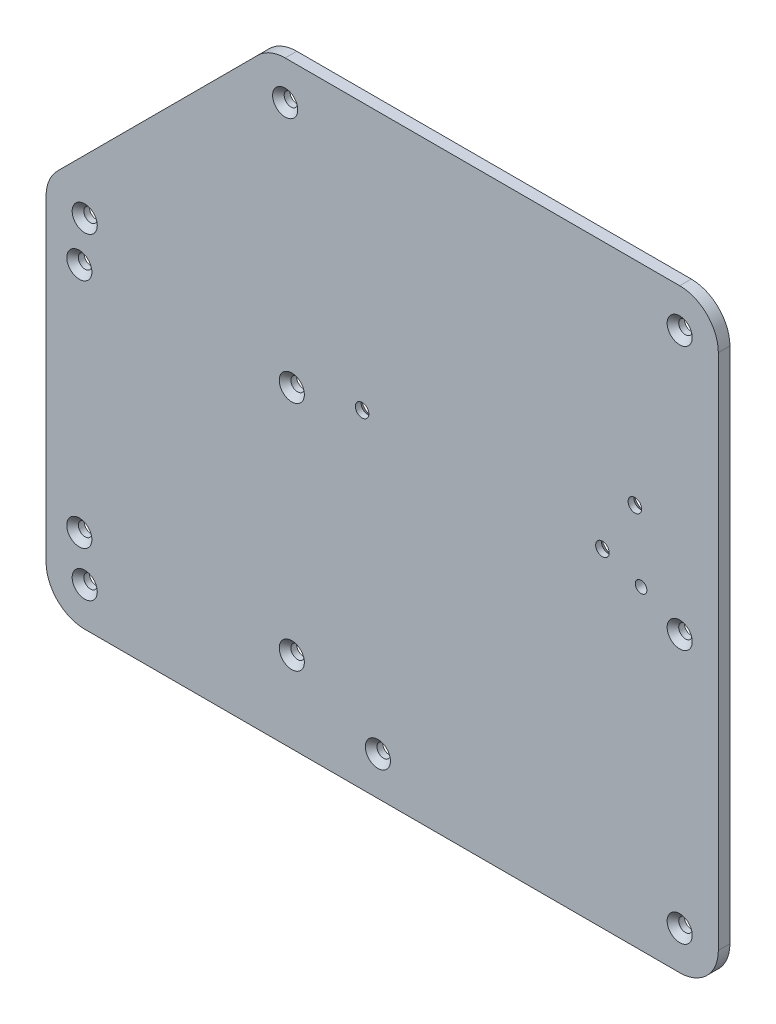
from build123d import *

# Parameters (mm, degrees)
ESTRUSIONE_ESTRUSIONE1_DEPTH = 3
RACCORDO1_R                  = 10
SCHIZZO2_R                   = 1.75
TAGLIO_ESTRUSIONE1_DEPTH     = 3
SMUSSO1_SIZE                 = 1.5
SCHIZZO4_R                   = 1.75
SCHIZZO4_R_2                 = 1.5
TAGLIO_ESTRUSIONE2_DEPTH     = 230.558271469
SCHIZZO3_R                   = 1.75
TAGLIO_ESTRUSIONE3_DEPTH     = 10
SMUSSO2_SIZE                 = 1.5


with BuildPart() as part:
    # Schizzo1 → Estrusione-Estrusione1 (new body)
    with BuildSketch(Plane.XY):
        Polygon((172, 152), (55.74011537, 152), (-2, 94.25988463), (-2, -2), (172, -2), align=None)
    extrude(amount=ESTRUSIONE_ESTRUSIONE1_DEPTH)

    # Raccordo1
    raccordo1_edges = [part.edges().sort_by_distance(p)[0] for p in [
        (172, -2, 1.5),
        (-2, -2, 1.5),
        (-2, 94.25988463, 1.5),
        (55.74011537, 152, 1.5),
        (172, 152, 1.5),
    ]]
    fillet(raccordo1_edges, radius=RACCORDO1_R)

    # Schizzo2 → Taglio-Estrusione1 (cut)
    with BuildSketch(Plane.XY.offset(3)):
        with Locations((162, 142)):
            Circle(SCHIZZO2_R)
        with Locations((59.882250994, 142)):
            Circle(SCHIZZO2_R)
        with Locations((8, 90.117749006)):
            Circle(SCHIZZO2_R)
        with Locations((8, 8)):
            Circle(SCHIZZO2_R)
        with Locations((162, 8)):
            Circle(SCHIZZO2_R)
        with Locations((162, 73.82941029)):
            Circle(SCHIZZO2_R)
        with Locations((83.881838923, 8)):
            Circle(SCHIZZO2_R)
    extrude(amount=-TAGLIO_ESTRUSIONE1_DEPTH, mode=Mode.SUBTRACT)

    # Smusso1
    smusso1_edges = [part.edges().sort_by_distance(p)[0] for p in [
        (58.132250994, 142, 3),
        (6.25, 90.117749006, 3),
        (6.25, 8, 3),
        (160.25, 8, 3),
        (160.25, 73.82941029, 3),
        (82.131838923, 8, 3),
        (160.25, 142, 3),
    ]]
    chamfer(smusso1_edges, length=SMUSSO1_SIZE)

    # Schizzo4 → Taglio-Estrusione2 (cut, through all)
    with BuildSketch(Plane.XY.offset(3)):
        with Locations((150.4, 97)):
            Circle(SCHIZZO4_R)
        with Locations((142, 83)):
            Circle(SCHIZZO4_R)
        with Locations((79.8, 83)):
            Circle(SCHIZZO4_R)
        with Locations((152, 79.499997822)):
            Circle(SCHIZZO4_R_2)
    extrude(amount=-TAGLIO_ESTRUSIONE2_DEPTH, mode=Mode.SUBTRACT)

    # Schizzo3 → Taglio-Estrusione3 (cut)
    with BuildSketch(Plane(origin=(0, 0, 0), x_dir=(-1, 0, 0), z_dir=(0, 0, -1))):
        with Locations((-61.6, 79)):
            Circle(SCHIZZO3_R)
        with Locations((-6.6, 79)):
            Circle(SCHIZZO3_R)
        with Locations((-6.6, 19)):
            Circle(SCHIZZO3_R)
        with Locations((-61.6, 19)):
            Circle(SCHIZZO3_R)
    extrude(amount=-TAGLIO_ESTRUSIONE3_DEPTH, mode=Mode.SUBTRACT)

    # Smusso2
    smusso2_edges = [part.edges().sort_by_distance(p)[0] for p in [
        (148.65, 97, 0),
        (140.25, 83, 0),
        (78.05, 83, 0),
        (63.35, 19, 3),
        (8.35, 19, 3),
        (8.35, 79, 3),
        (63.35, 79, 3),
    ]]
    chamfer(smusso2_edges, length=SMUSSO2_SIZE)


solid = part.part
